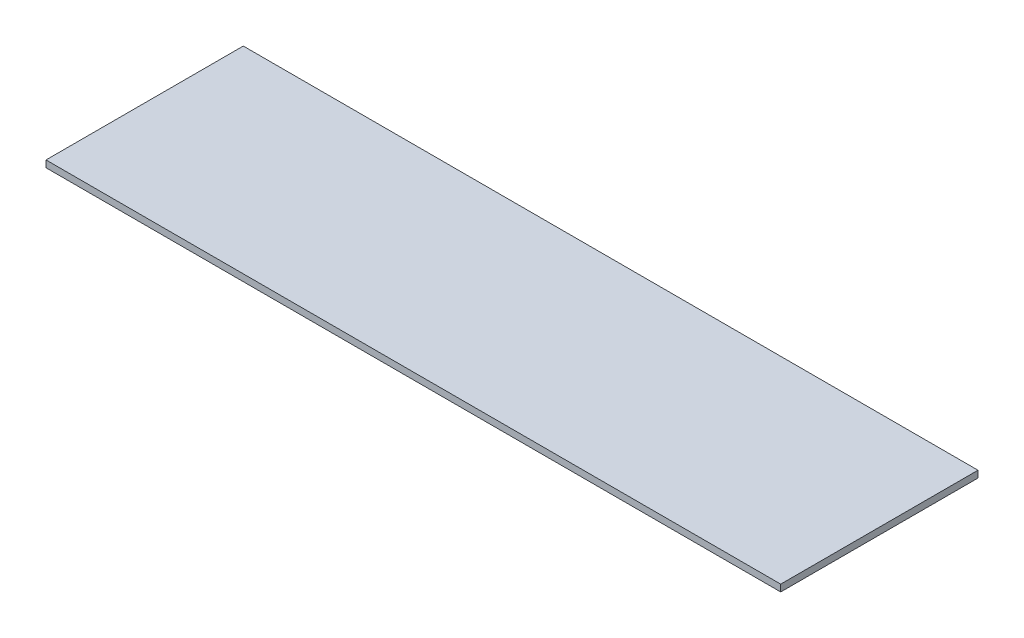
from build123d import *

# Parameters (mm, degrees)
SKETCH1_W           = 540
SKETCH1_H           = 145
BOSS_EXTRUDE1_DEPTH = 5


with BuildPart() as part:
    # Sketch1 → Boss-Extrude1 (new body)
    with BuildSketch(Plane(origin=(0, 0, 0), x_dir=(1, 0, 0), z_dir=(0, 1, 0))):
        with Locations((-270, -72.5)):
            Rectangle(SKETCH1_W, SKETCH1_H)
    extrude(amount=BOSS_EXTRUDE1_DEPTH)


solid = part.part
